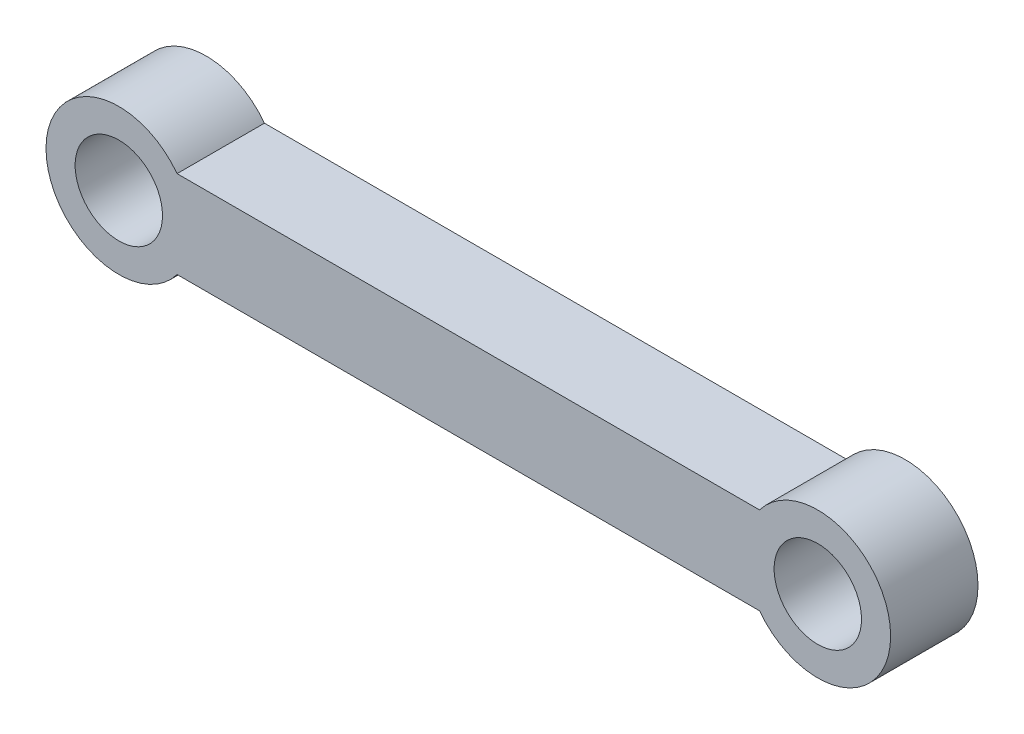
from build123d import *

# Parameters (mm, degrees)
EXTRUDE_1_DEPTH = 6


with BuildPart() as part:
    # 草图1 → 凸台-拉伸1 (new body)
    with BuildSketch(Plane.XY):
        with BuildLine():
            Line((20, 3), (-20, 3))
            ThreePointArc((-20, 3), (-19.25658351, 1.58113883), (-19, 0))
            ThreePointArc((-19, 0), (-19.25658351, -1.58113883), (-20, -3))
            Line((-20, -3), (20, -3))
            ThreePointArc((20, -3), (19, 0), (20, 3))
        make_face()
        with BuildLine():
            ThreePointArc((-24, -3), (-27, 0), (-24, 3))
            Line((-24, 3), (-20, 3))
            ThreePointArc((-20, 3), (-21.763932022, 4.472135955), (-24, 5))
            ThreePointArc((-24, 5), (-29, 0), (-24, -5))
            ThreePointArc((-24, -5), (-21.763932022, -4.472135955), (-20, -3))
            Line((-20, -3), (-24, -3))
        make_face()
        with BuildLine():
            Line((-20, 3), (-24, 3))
            ThreePointArc((-24, 3), (-21.878679656, 2.121320344), (-21, 0))
            ThreePointArc((-21, 0), (-21.878679656, -2.121320344), (-24, -3))
            Line((-24, -3), (-20, -3))
            ThreePointArc((-20, -3), (-19.25658351, -1.58113883), (-19, 0))
            ThreePointArc((-19, 0), (-19.25658351, 1.58113883), (-20, 3))
        make_face()
        with BuildLine():
            ThreePointArc((24, 5), (21.763932023, 4.472135955), (20, 3))
            Line((20, 3), (24, 3))
            ThreePointArc((24, 3), (26.121320344, 2.121320344), (27, 0))
            ThreePointArc((27, 0), (26.121320344, -2.121320344), (24, -3))
            Line((24, -3), (20, -3))
            ThreePointArc((20, -3), (21.763931997, -4.472135942), (23.999999943, -5))
            ThreePointArc((23.999999943, -5), (27.535533886, -3.535533926), (29, 0))
            ThreePointArc((29, 0), (27.535533906, 3.535533906), (24, 5))
        make_face()
        with BuildLine():
            Line((24, 3), (20, 3))
            ThreePointArc((20, 3), (19, 0), (20, -3))
            Line((20, -3), (24, -3))
            ThreePointArc((24, -3), (21, 0), (24, 3))
        make_face()
    extrude(amount=EXTRUDE_1_DEPTH)


solid = part.part
